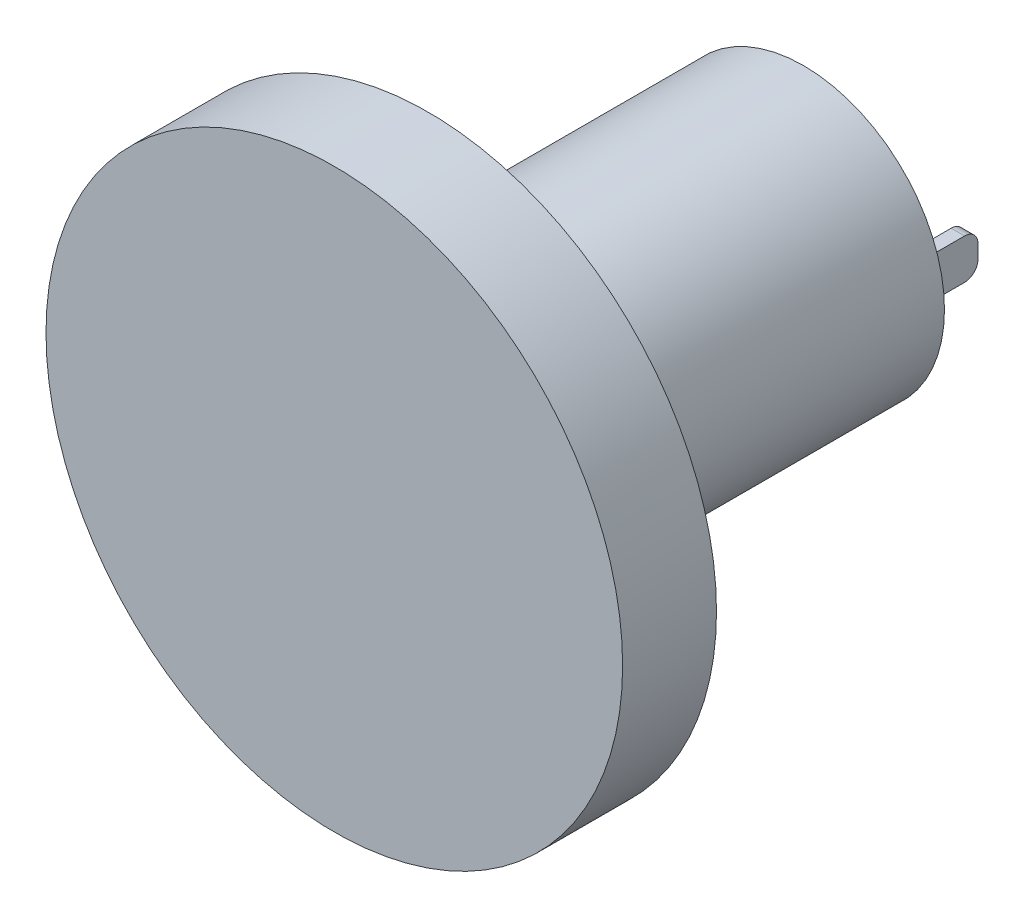
from build123d import *

# Parameters (mm, degrees)
ESQUISSE1_R        = 10.5
BOSS_EXTRU_1_DEPTH = 21
ESQUISSE2_R        = 8.5
BOSS_EXTRU_2_DEPTH = 4
ESQUISSE3_R        = 3
BOSS_EXTRU_3_DEPTH = 2
ESQUISSE4_R        = 1
BOSS_EXTRU_4_DEPTH = 8
ESQUISSE5_W        = 1
ESQUISSE5_H        = 3
BOSS_EXTRU_5_DEPTH = 5
CONG_1_R           = 1
BOSS_EXTRU_6_START = 3
BOSS_EXTRU_6_DEPTH = 3
BOSS_EXTRU_7_START = 1
ESQUISSE7_R        = 1
BOSS_EXTRU_7_DEPTH = 1
ESQUISSE8_R        = 21.5
BOSS_EXTRU_8_DEPTH = 7


with BuildPart() as part:
    # Esquisse1 → Boss.-Extru.1 (new body)
    with BuildSketch(Plane.XY):
        with Locations((-10.784512349, 4.354613187)):
            Circle(ESQUISSE1_R)
    extrude(amount=BOSS_EXTRU_1_DEPTH)

    # Esquisse2 → Boss.-Extru.2 (add)
    with BuildSketch(Plane.XY.offset(21)):
        with Locations((-10.784512349, 4.354613187)):
            Circle(ESQUISSE2_R)
    extrude(amount=BOSS_EXTRU_2_DEPTH)

    # Esquisse3 → Boss.-Extru.3 (add)
    with BuildSketch(Plane.XY.offset(25)):
        with Locations((-10.784512349, 4.354613187)):
            Circle(ESQUISSE3_R)
    extrude(amount=BOSS_EXTRU_3_DEPTH)

    # Esquisse4 → Boss.-Extru.4 (add)
    with BuildSketch(Plane.XY.offset(27)):
        with Locations((-10.784512349, 4.354613187)):
            Circle(ESQUISSE4_R)
    extrude(amount=BOSS_EXTRU_4_DEPTH)

    # Esquisse5 → Boss.-Extru.5 (add)
    with BuildSketch(Plane(origin=(0, 0, 0), x_dir=(-1, 0, 0), z_dir=(0, 0, -1))):
        with Locations((18.284512349, 4.354613187)):
            Rectangle(ESQUISSE5_W, ESQUISSE5_H)
        with Locations((3.284512349, 4.354613187)):
            Rectangle(ESQUISSE5_W, ESQUISSE5_H)
    extrude(amount=BOSS_EXTRU_5_DEPTH)

    # Congé1
    cong_1_edges = [part.edges().sort_by_distance(p)[0] for p in [
        (-18.284512349, 2.854613187, -5),
        (-18.284512349, 5.854613187, -5),
        (-3.284512349, 2.854613187, -5),
        (-3.284512349, 5.854613187, -5),
    ]]
    fillet(cong_1_edges, radius=CONG_1_R)

    # Esquisse6 → Boss.-Extru.6 (add)
    with BuildSketch(Plane(origin=(0, 0, 0), x_dir=(-1, 0, 0), z_dir=(0, 0, -1)).offset(BOSS_EXTRU_6_START)):
        with BuildLine():
            Line((8.784512349, 6.590681164), (12.784512349, 6.590681164))
            ThreePointArc((12.784512349, 6.590681164), (10.784512349, 1.354613187), (8.784512349, 6.590681164))
        make_face()
    extrude(amount=-BOSS_EXTRU_6_DEPTH)

    # Esquisse7 → Boss.-Extru.7 (add)
    with BuildSketch(Plane(origin=(0, 0, -3), x_dir=(-1, 0, 0), z_dir=(0, 0, -1)).offset(BOSS_EXTRU_7_START)):
        with Locations((10.784512349, 4.354613187)):
            Circle(ESQUISSE7_R)
    extrude(amount=-BOSS_EXTRU_7_DEPTH)

    # Esquisse8 → Boss.-Extru.8 (add)
    with BuildSketch(Plane.XY.offset(35)):
        with Locations((-10.784512349, 4.354613187)):
            Circle(ESQUISSE8_R)
    extrude(amount=-BOSS_EXTRU_8_DEPTH)


solid = part.part
